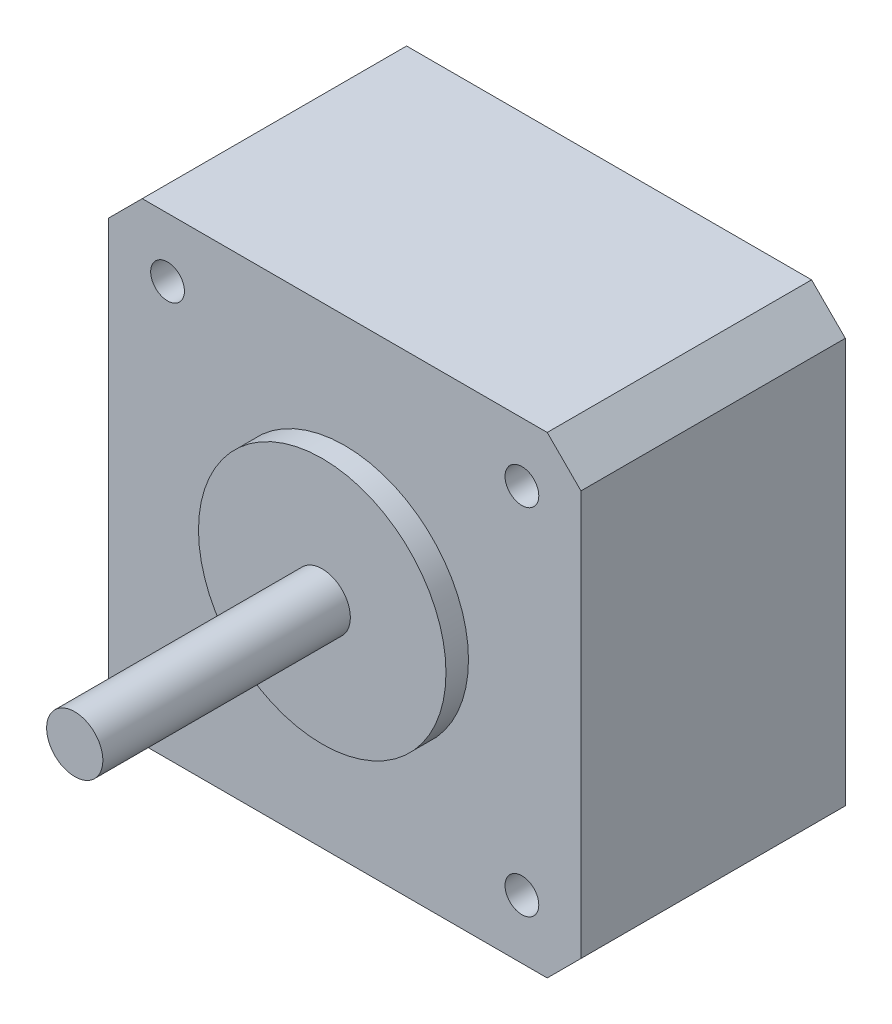
from build123d import *

# Parameters (mm, degrees)
SKETCH1_W           = 42
SKETCH1_H           = 42
BOSS_EXTRUDE1_DEPTH = 23.5
SKETCH2_R           = 11
BOSS_EXTRUDE2_DEPTH = 2
SKETCH3_R           = 2.5
BOSS_EXTRUDE3_DEPTH = 22
CHAMFER1_SIZE       = 3
SKETCH4_R           = 1.5
CUT_EXTRUDE1_DEPTH  = 10


with BuildPart() as part:
    # Sketch1 → Boss-Extrude1 (new body)
    with BuildSketch(Plane.XY):
        Rectangle(SKETCH1_W, SKETCH1_H)
    extrude(amount=BOSS_EXTRUDE1_DEPTH)

    # Sketch2 → Boss-Extrude2 (add)
    with BuildSketch(Plane.XY.offset(23.5)):
        Circle(SKETCH2_R)
    extrude(amount=BOSS_EXTRUDE2_DEPTH)

    # Sketch3 → Boss-Extrude3 (add)
    with BuildSketch(Plane.XY.offset(25.5)):
        Circle(SKETCH3_R)
    extrude(amount=BOSS_EXTRUDE3_DEPTH)

    # Chamfer1
    chamfer1_edges = [part.edges().sort_by_distance(p)[0] for p in [
        (21, -21, 11.75),
        (-21, -21, 11.75),
        (-21, 21, 11.75),
        (21, 21, 11.75),
    ]]
    chamfer(chamfer1_edges, length=CHAMFER1_SIZE)

    # Sketch4 → Cut-Extrude1 (cut)
    with BuildSketch(Plane.XY.offset(23.5)):
        with Locations((-15.75, 15.75)):
            Circle(SKETCH4_R)
        with Locations((15.75, 15.75)):
            Circle(SKETCH4_R)
        with Locations((-15.75, -15.75)):
            Circle(SKETCH4_R)
        with Locations((15.75, -15.75)):
            Circle(SKETCH4_R)
    extrude(amount=-CUT_EXTRUDE1_DEPTH, mode=Mode.SUBTRACT)


solid = part.part
